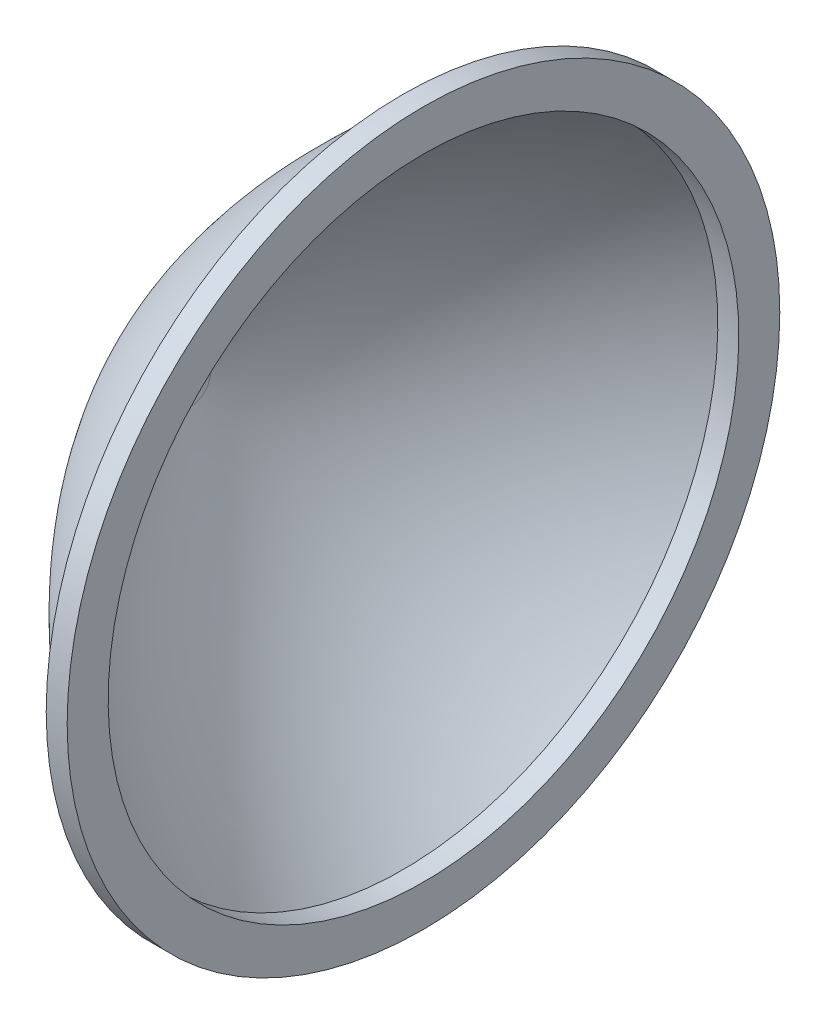
from build123d import *


with BuildPart() as part:
    # Esquisse1 → Révolution4 (revolve)
    with BuildSketch(Plane.XY):
        with BuildLine():
            Line((-45.641969606, 0), (-50, 0))
            add(Edge.make_bspline(
                [(-3.999999997, 65.171523585), (-38.761790775, 39.718563846), (-50, 0)],
                knots=[0.053439051, 0.053439051, 0.053439051, 1, 1, 1], degree=2))
            Line((-3.999999997, 65.171523585), (-3.999999997, 68))
            Line((-3.999999997, 68), (3e-09, 68))
            Line((3e-09, 68), (3e-09, 60.17556509))
            Line((3e-09, 60.17556509), (-3.999999997, 60.17556509))
            add(Edge.make_bspline(
                [(-3.999999997, 60.17556509), (-15.093792802, 51.683800687), (-29.193456354, 35.006616283), (-40.418134085, 16.6205085), (-44.591534168, 4)],
                knots=[0.086931033, 0.086931033, 0.086931033, 0.405562538, 0.617983541, 0.936615045, 0.936615045, 0.936615045], degree=2))
            Line((-44.591534168, 4), (-45.641969606, 0))
        make_face()
    revolve(axis=Axis((-45.641969606, 0, 0), (-1, 0, 0)))


solid = part.part
